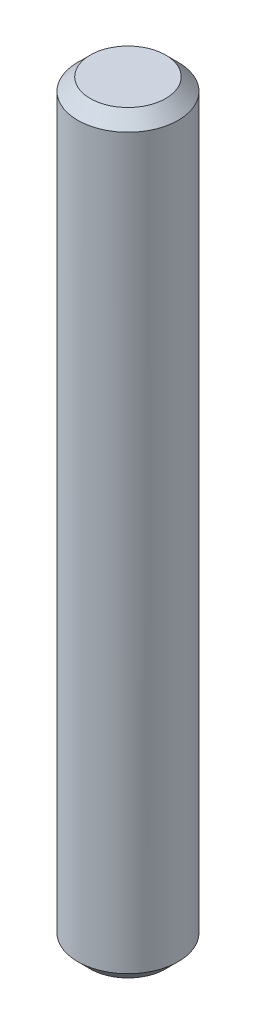
from build123d import *

# Parameters (mm, degrees)
SKETCH1_W     = 2
SKETCH1_H     = 30
CHAMFER1_SIZE = 0.5


with BuildPart() as part:
    # Sketch1 → Revolve1 (revolve)
    with BuildSketch(Plane.XY, mode=Mode.PRIVATE) as revolve1_sk:
        with Locations((1, 0)):
            Rectangle(SKETCH1_W, SKETCH1_H)
    revolve(revolve1_sk.sketch.rotate(Axis((0, 15, 0), (0, -1, 0)), 180), axis=Axis((0, 15, 0), (0, -1, 0)))

    # Chamfer1
    chamfer1_edges = [part.edges().sort_by_distance(p)[0] for p in [
        (2, 15, 0),
        (2, -15, 0),
    ]]
    chamfer(chamfer1_edges, length=CHAMFER1_SIZE)


solid = part.part
